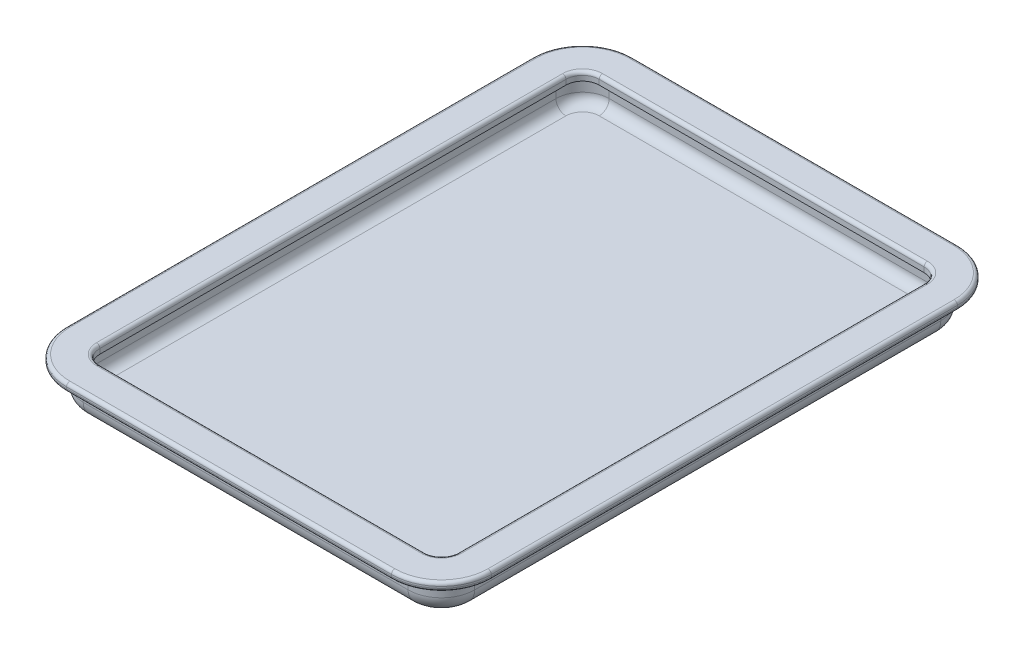
from build123d import *

# Parameters (mm, degrees)
SKETCH1_W           = 149.352
SKETCH1_H           = 203.2
BOSS_EXTRUDE1_DEPTH = 12.7
FILLET1_R           = 12.7
FILLET3_R           = 6.35
SHELL1_T            = -2.54
BOSS_EXTRUDE2_DEPTH = 3.175
FILLET2_R           = 1.27


with BuildPart() as part:
    # Sketch1 → Boss-Extrude1 (new body)
    with BuildSketch(Plane(origin=(0, 0, 0), x_dir=(1, 0, 0), z_dir=(0, 1, 0))):
        Rectangle(SKETCH1_W, SKETCH1_H)
    extrude(amount=BOSS_EXTRUDE1_DEPTH)

    # Fillet1
    fillet1_edges = [part.edges().sort_by_distance(p)[0] for p in [
        (74.676, 6.35, 101.6),
        (-74.676, 6.35, 101.6),
        (-74.676, 6.35, -101.6),
        (74.676, 6.35, -101.6),
    ]]
    fillet(fillet1_edges, radius=FILLET1_R)

    # Fillet3
    fillet3_edges = [part.edges().sort_by_distance(p)[0] for p in [
        (-74.676, 0, 0),
        (74.676, 0, 0),
        (0, 0, 101.6),
        (0, 0, -101.6),
        (70.956256121, 0, 97.880256121),
        (70.956256121, 0, -97.880256121),
        (-70.956256121, 0, 97.880256121),
        (-70.956256121, 0, -97.880256121),
    ]]
    fillet(fillet3_edges, radius=FILLET3_R)

    # Shell1
    shell1_openings = [part.faces().sort_by_distance(p)[0] for p in [
        (0, 12.7, 0),
    ]]
    offset(amount=SHELL1_T, openings=shell1_openings, kind=Kind.INTERSECTION)

    # Sketch2 → Boss-Extrude2 (add)
    with BuildSketch(Plane(origin=(0, 12.7, 0), x_dir=(1, 0, 0), z_dir=(0, 1, 0))):
        with BuildLine():
            Line((61.976, 107.95), (-61.976, 107.95))
            ThreePointArc((-61.976, 107.95), (-75.446384182, 102.370384182), (-81.026, 88.9))
            Line((-81.026, 88.9), (-81.026, -88.9))
            ThreePointArc((-81.026, -88.9), (-75.446384182, -102.370384182), (-61.976, -107.95))
            Line((-61.976, -107.95), (61.976, -107.95))
            ThreePointArc((61.976, -107.95), (75.446384182, -102.370384182), (81.026, -88.9))
            Line((81.026, -88.9), (81.026, 88.9))
            ThreePointArc((81.026, 88.9), (75.446384182, 102.370384182), (61.976, 107.95))
        make_face()
        with BuildLine():
            Line((-68.326, -88.9), (-68.326, 88.9))
            ThreePointArc((-68.326, 88.9), (-66.466128061, 93.390128061), (-61.976, 95.25))
            Line((-61.976, 95.25), (61.976, 95.25))
            ThreePointArc((61.976, 95.25), (66.466128061, 93.390128061), (68.326, 88.9))
            Line((68.326, 88.9), (68.326, -88.9))
            ThreePointArc((68.326, -88.9), (66.466128061, -93.390128061), (61.976, -95.25))
            Line((61.976, -95.25), (-61.976, -95.25))
            ThreePointArc((-61.976, -95.25), (-66.466128061, -93.390128061), (-68.326, -88.9))
        make_face(mode=Mode.SUBTRACT)
    extrude(amount=BOSS_EXTRUDE2_DEPTH)

    # Fillet2
    fillet2_edges = [part.edges().sort_by_distance(p)[0] for p in [
        (-81.026, 15.875, 0),
        (-75.446384182, 15.875, 102.370384182),
        (0, 15.875, 107.95),
        (75.446384182, 15.875, 102.370384182),
        (81.026, 15.875, 0),
        (75.446384182, 12.7, -102.370384182),
        (0, 12.7, -107.95),
        (-75.446384182, 12.7, -102.370384182),
        (-81.026, 12.7, 0),
        (-75.446384182, 12.7, 102.370384182),
        (0, 12.7, 107.95),
        (75.446384182, 12.7, 102.370384182),
        (81.026, 12.7, 0),
        (-66.466128061, 15.875, 93.390128061),
        (0, 15.875, 95.25),
        (66.466128061, 15.875, 93.390128061),
        (68.326, 15.875, 0),
        (66.466128061, 15.875, -93.390128061),
        (0, 15.875, -95.25),
        (-66.466128061, 15.875, -93.390128061),
        (-68.326, 15.875, 0),
        (75.446384182, 15.875, -102.370384182),
        (0, 15.875, -107.95),
        (-75.446384182, 15.875, -102.370384182),
    ]]
    fillet(fillet2_edges, radius=FILLET2_R)


solid = part.part
